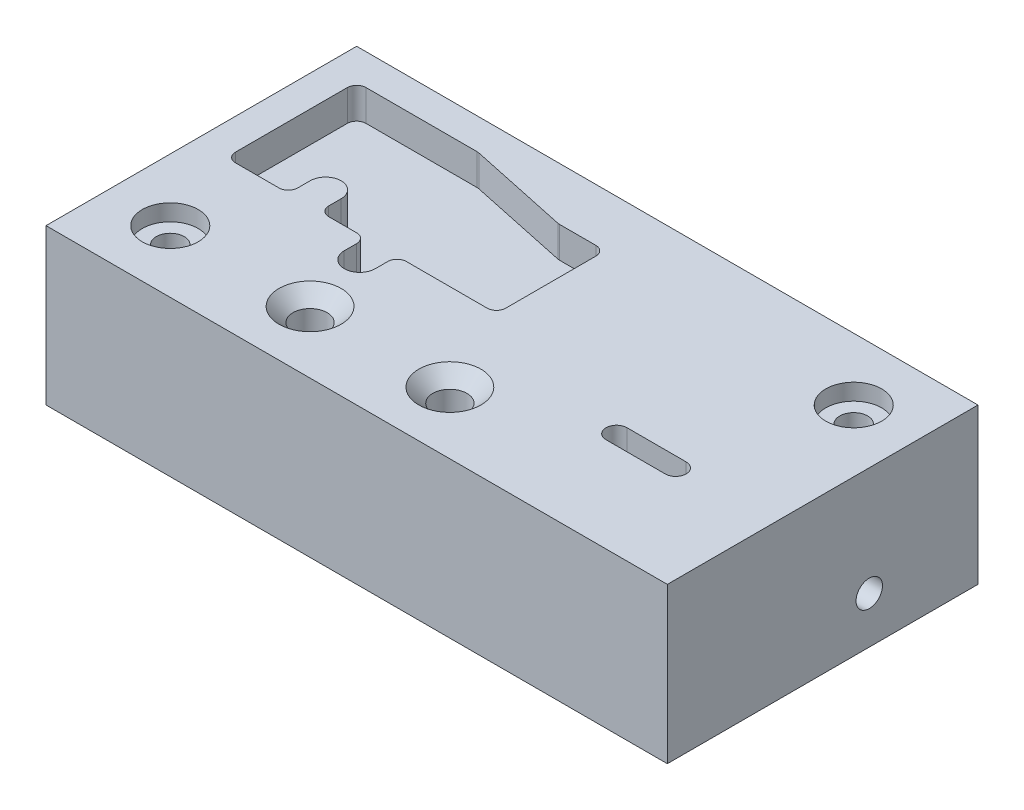
from build123d import *

# Parameters (mm, degrees)
SKETCH1_W                                            = 200
SKETCH1_H                                            = 100
BLOCK_STOCK_DEPTH                                    = 50
M10_TAPPED_HOLE1_D                                   = 8.5
M10_TAPPED_HOLE1_DEPTH                               = 25
M10_TAPPED_HOLE1_TIP                                 = 2.553657631
CBORE_FOR_M8_HEX_HEAD_BOLT1_D                        = 9
CBORE_FOR_M8_HEX_HEAD_BOLT1_CBORE_D                  = 18.011
CBORE_FOR_M8_HEX_HEAD_BOLT1_CBORE_DEPTH              = 5.3
POCKET_1_DEPTH                                       = 10
CSK_FOR_M10_CROSS_RECESS_FLAT_HEAD_SCREW_D           = 11
CSK_FOR_M10_CROSS_RECESS_FLAT_HEAD_SCREW_CSINK_D     = 20
CSK_FOR_M10_CROSS_RECESS_FLAT_HEAD_SCREW_CSINK_ANGLE = 90
SLOT_DEPTH                                           = 398.580729973


with BuildPart() as part:
    # Sketch1 → Block Stock (new body)
    with BuildSketch(Plane(origin=(0, 0, 0), x_dir=(1, 0, 0), z_dir=(0, 1, 0))):
        Rectangle(SKETCH1_W, SKETCH1_H)
    extrude(amount=BLOCK_STOCK_DEPTH)

    # M10 Tapped Hole1
    with Locations(Plane(origin=(100, 0, 0), x_dir=(0, 0, -1), z_dir=(1, 0, 0))):
        with Locations((15, 15)):
            Hole(M10_TAPPED_HOLE1_D / 2, depth=M10_TAPPED_HOLE1_DEPTH)
            with Locations((0, 0, -(M10_TAPPED_HOLE1_DEPTH + M10_TAPPED_HOLE1_TIP / 2))):  # 118° drill point
                Cone(0, M10_TAPPED_HOLE1_D / 2, M10_TAPPED_HOLE1_TIP, mode=Mode.SUBTRACT)

    # CBORE for M8 Hex Head Bolt1 (through all)
    with Locations(Plane(origin=(0, 50, 0), x_dir=(-1, 0, 0), z_dir=(0, 1, 0))):
        with Locations((80, 30), (-80, -30)):
            CounterBoreHole(CBORE_FOR_M8_HEX_HEAD_BOLT1_D / 2, CBORE_FOR_M8_HEX_HEAD_BOLT1_CBORE_D / 2, CBORE_FOR_M8_HEX_HEAD_BOLT1_CBORE_DEPTH)

    # Sketch2 → Pocket 1 (cut)
    with BuildSketch(Plane(origin=(0, 50, 0), x_dir=(1, 0, 0), z_dir=(0, 1, 0))):
        with BuildLine():
            Line((-87, 40), (-51.247723472, 40))
            ThreePointArc((-51.247723472, 40), (-50.934138082, 39.983565686), (-50.6239884, 39.934442802))
            Line((-50.6239884, 39.934442802), (-18.308422367, 33.065557198))
            ThreePointArc((-18.308422367, 33.065557198), (-17.998272684, 33.016434314), (-17.684687294, 33))
            Line((-17.684687294, 33), (-6, 33))
            ThreePointArc((-6, 33), (-3.878679656, 32.121320344), (-3, 30))
            Line((-3, 30), (-3, 1))
            ThreePointArc((-3, 1), (-3.878679656, -1.121320344), (-6, -2))
            Line((-6, -2), (-32, -2))
            ThreePointArc((-32, -2), (-34.121320344, -2.878679656), (-35, -5))
            Line((-35, -5), (-35, -9))
            ThreePointArc((-35, -9), (-40, -14), (-45, -9))
            Line((-45, -9), (-45, -5))
            ThreePointArc((-45, -5), (-45.878679656, -2.878679656), (-48, -2))
            Line((-48, -2), (-57, -2))
            ThreePointArc((-57, -2), (-59.121320344, -1.121320344), (-60, 1))
            Line((-60, 1), (-60, 5))
            ThreePointArc((-60, 5), (-65, 10), (-70, 5))
            Line((-70, 5), (-70, 1))
            ThreePointArc((-70, 1), (-70.878679656, -1.121320344), (-73, -2))
            Line((-73, -2), (-87, -2))
            ThreePointArc((-87, -2), (-89.121320344, -1.121320344), (-90, 1))
            Line((-90, 1), (-90, 37))
            ThreePointArc((-90, 37), (-89.121320344, 39.121320344), (-87, 40))
        make_face()
    extrude(amount=-POCKET_1_DEPTH, mode=Mode.SUBTRACT)

    # CSK for M10 Cross Recess Flat Head Screw1 (through all)
    with Locations(Plane(origin=(0, 50, 0), x_dir=(-1, 0, 0), z_dir=(0, 1, 0))):
        with Locations((-10, 30), (35, 30)):
            CounterSinkHole(CSK_FOR_M10_CROSS_RECESS_FLAT_HEAD_SCREW_D / 2, CSK_FOR_M10_CROSS_RECESS_FLAT_HEAD_SCREW_CSINK_D / 2, counter_sink_angle=CSK_FOR_M10_CROSS_RECESS_FLAT_HEAD_SCREW_CSINK_ANGLE)

    # SlotSke → Slot (cut, through all)
    with BuildSketch(Plane(origin=(218.703654527, 50, 182.375595614), x_dir=(1, 0, 0), z_dir=(0, 1, 0))):
        with BuildLine():
            Line((-149.826827264, 162.822297807), (-168.876827264, 162.822297807))
            ThreePointArc((-168.876827264, 162.822297807), (-172.242327264, 166.187797807), (-168.876827264, 169.553297807))
            Line((-168.876827264, 169.553297807), (-149.826827264, 169.553297807))
            ThreePointArc((-149.826827264, 169.553297807), (-146.461327264, 166.187797807), (-149.826827264, 162.822297807))
        make_face()
    extrude(amount=-SLOT_DEPTH, mode=Mode.SUBTRACT)


solid = part.part
